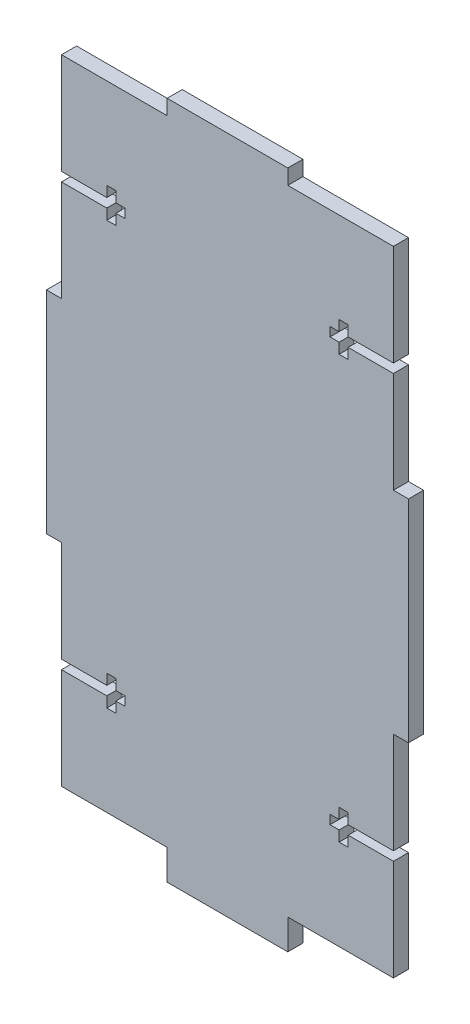
from build123d import *

# Parameters (mm, degrees)
SALIENTE_EXTRUIR1_DEPTH = 5


with BuildPart() as part:
    # Croquis1 → Saliente-Extruir1 (new body)
    with BuildSketch(Plane.XY):
        Polygon((0, 0), (35, 0), (35, -10), (75, -10), (75, 0), (110, 0), (110, 33.5), (95, 33.5), (95, 30), (92, 30), (92, 33.5), (89, 33.5), (89, 36.5), (92, 36.5), (92, 40), (95, 40), (95, 36.5), (110, 36.5), (110, 70), (115, 70), (115, 140), (110, 140), (110, 173.5), (95, 173.5), (95, 170), (92, 170), (92, 173.5), (89, 173.5), (89, 176.5), (92, 176.5), (92, 180), (95, 180), (95, 176.5), (110, 176.5), (110, 210), (75, 210), (75, 215), (35, 215), (35, 210), (0, 210), (0, 176.5), (15, 176.5), (15, 180), (18, 180), (18, 176.5), (21, 176.5), (21, 173.5), (18, 173.5), (18, 170), (15, 170), (15, 173.5), (0, 173.5), (0, 140), (-5, 140), (-5, 70), (0, 70), (0, 36.5), (15, 36.5), (15, 40), (18, 40), (18, 36.5), (21, 36.5), (21, 33.5), (18, 33.5), (18, 30), (15, 30), (15, 33.5), (0, 33.5), align=None)
    extrude(amount=SALIENTE_EXTRUIR1_DEPTH)


solid = part.part
